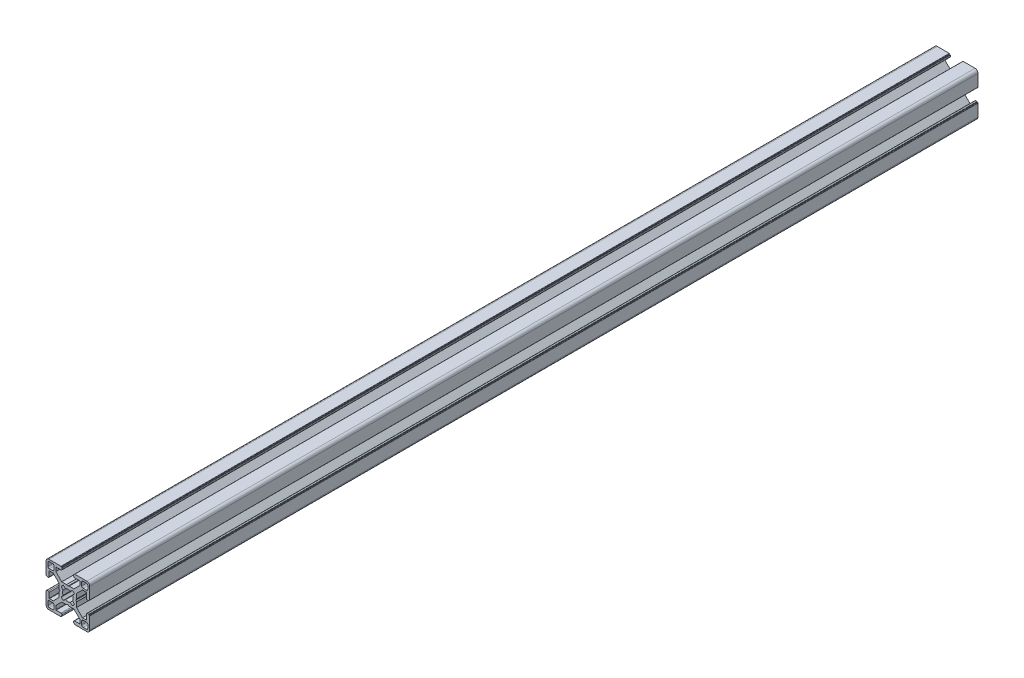
from build123d import *

# Parameters (mm, degrees)
BOSS_EXTRUDE1_DEPTH = 610


with BuildPart() as part:
    # Sketch1 → Boss-Extrude1 (new body)
    with BuildSketch(Plane.XY.offset(25)):
        with BuildLine():
            Line((-4.05, 13.399999434), (-4.05, 14.299999626))
            ThreePointArc((-4.05, 14.299999626), (-4.108578753, 14.441421247), (-4.250000374, 14.5))
            Line((-4.250000374, 14.5), (-4.350000144, 14.5))
            ThreePointArc((-4.350000144, 14.5), (-4.49142109, 14.558578474), (-4.549999564, 14.69999942))
            Line((-4.549999564, 14.69999942), (-4.549999564, 14.799999619))
            ThreePointArc((-4.549999564, 14.799999619), (-4.60857832, 14.941421245), (-4.749999945, 15))
            Line((-4.749999945, 15), (-13.000000346, 15))
            ThreePointArc((-13.000000346, 15), (-14.414213664, 14.414213664), (-15, 13.000000346))
            Line((-15, 13.000000346), (-15, 4.749999521))
            ThreePointArc((-15, 4.749999521), (-14.941421273, 4.608577964), (-14.799999716, 4.549999237))
            Line((-14.799999716, 4.549999237), (-14.700000611, 4.549999237))
            ThreePointArc((-14.700000611, 4.549999237), (-14.558579054, 4.49142051), (-14.500000327, 4.349998953))
            Line((-14.500000327, 4.349998953), (-14.500000327, 4.249999521))
            ThreePointArc((-14.500000327, 4.249999521), (-14.4414216, 4.108577964), (-14.300000043, 4.049999237))
            Line((-14.300000043, 4.049999237), (-13.39999994, 4.049999237))
            ThreePointArc((-13.39999994, 4.049999237), (-12.975735606, 4.225735278), (-12.799999564, 4.649999613))
            Line((-12.799999564, 4.649999613), (-12.799999564, 8.049999716))
            ThreePointArc((-12.799999564, 8.049999716), (-12.741420837, 8.191421273), (-12.59999928, 8.25))
            Line((-12.59999928, 8.25), (-10.049999564, 8.25))
            Line((-10.049999564, 8.25), (-6.00446543, 4.204465866))
            Line((-6.00446543, 4.204465866), (-6.00446543, 0.899999619))
            Line((-6.00446543, 0.899999619), (-5.484852164, 0))
            Line((-5.484852164, 0), (-6.00446543, -0.899999619))
            Line((-6.00446543, -0.899999619), (-6.00446543, -4.204465866))
            Line((-6.00446543, -4.204465866), (-10.049999564, -8.25))
            Line((-10.049999564, -8.25), (-12.59999928, -8.25))
            ThreePointArc((-12.59999928, -8.25), (-12.741420837, -8.191421273), (-12.799999564, -8.049999716))
            Line((-12.799999564, -8.049999716), (-12.799999564, -4.649999613))
            ThreePointArc((-12.799999564, -4.649999613), (-12.975735606, -4.225735278), (-13.39999994, -4.049999237))
            Line((-13.39999994, -4.049999237), (-14.300000043, -4.049999237))
            ThreePointArc((-14.300000043, -4.049999237), (-14.4414216, -4.108577964), (-14.500000327, -4.249999521))
            Line((-14.500000327, -4.249999521), (-14.500000327, -4.349998953))
            ThreePointArc((-14.500000327, -4.349998953), (-14.558579054, -4.49142051), (-14.700000611, -4.549999237))
            Line((-14.700000611, -4.549999237), (-14.799999716, -4.549999237))
            ThreePointArc((-14.799999716, -4.549999237), (-14.941421273, -4.608577964), (-15, -4.749999521))
            Line((-15, -4.749999521), (-15, -13.000000346))
            ThreePointArc((-15, -13.000000346), (-14.414213664, -14.414213664), (-13.000000346, -15))
            Line((-13.000000346, -15), (-4.749999945, -15))
            ThreePointArc((-4.749999945, -15), (-4.60857832, -14.941421245), (-4.549999564, -14.799999619))
            Line((-4.549999564, -14.799999619), (-4.549999564, -14.69999942))
            ThreePointArc((-4.549999564, -14.69999942), (-4.49142109, -14.558578474), (-4.350000144, -14.5))
            Line((-4.350000144, -14.5), (-4.250000374, -14.5))
            ThreePointArc((-4.250000374, -14.5), (-4.108578753, -14.441421247), (-4.05, -14.299999626))
            Line((-4.05, -14.299999626), (-4.05, -13.399999434))
            ThreePointArc((-4.05, -13.399999434), (-4.225735989, -12.975735226), (-4.650000197, -12.799999237))
            Line((-4.650000197, -12.799999237), (-8.049999924, -12.799999237))
            ThreePointArc((-8.049999924, -12.799999237), (-8.191421565, -12.741420475), (-8.250000327, -12.599998834))
            Line((-8.250000327, -12.599998834), (-8.250000327, -10.049999237))
            Line((-8.250000327, -10.049999237), (-4.204466193, -6))
            Line((-4.204466193, -6), (-0.899999946, -6))
            Line((-0.899999946, -6), (0, -5.484851837))
            Line((0, -5.484851837), (0.899999946, -6))
            Line((0.899999946, -6), (4.204466193, -6))
            Line((4.204466193, -6), (8.250000327, -10.049999237))
            Line((8.250000327, -10.049999237), (8.250000327, -12.599998834))
            ThreePointArc((8.250000327, -12.599998834), (8.191421565, -12.741420475), (8.049999924, -12.799999237))
            Line((8.049999924, -12.799999237), (4.650000197, -12.799999237))
            ThreePointArc((4.650000197, -12.799999237), (4.225735989, -12.975735226), (4.05, -13.399999434))
            Line((4.05, -13.399999434), (4.05, -14.299999626))
            ThreePointArc((4.05, -14.299999626), (4.108578753, -14.441421247), (4.250000374, -14.5))
            Line((4.250000374, -14.5), (4.350000144, -14.5))
            ThreePointArc((4.350000144, -14.5), (4.49142109, -14.558578474), (4.549999564, -14.69999942))
            Line((4.549999564, -14.69999942), (4.549999564, -14.799999619))
            ThreePointArc((4.549999564, -14.799999619), (4.60857832, -14.941421245), (4.749999945, -15))
            Line((4.749999945, -15), (13.000000346, -15))
            ThreePointArc((13.000000346, -15), (14.414213664, -14.414213664), (15, -13.000000346))
            Line((15, -13.000000346), (15, -4.749999521))
            ThreePointArc((15, -4.749999521), (14.941421273, -4.608577964), (14.799999716, -4.549999237))
            Line((14.799999716, -4.549999237), (14.700000611, -4.549999237))
            ThreePointArc((14.700000611, -4.549999237), (14.558579054, -4.49142051), (14.500000327, -4.349998953))
            Line((14.500000327, -4.349998953), (14.500000327, -4.249999521))
            ThreePointArc((14.500000327, -4.249999521), (14.4414216, -4.108577964), (14.300000043, -4.049999237))
            Line((14.300000043, -4.049999237), (13.39999994, -4.049999237))
            ThreePointArc((13.39999994, -4.049999237), (12.975735606, -4.225735278), (12.799999564, -4.649999613))
            Line((12.799999564, -4.649999613), (12.799999564, -8.049999716))
            ThreePointArc((12.799999564, -8.049999716), (12.741420837, -8.191421273), (12.59999928, -8.25))
            Line((12.59999928, -8.25), (10.049999564, -8.25))
            Line((10.049999564, -8.25), (6.00446543, -4.204465866))
            Line((6.00446543, -4.204465866), (6.00446543, -0.899999619))
            Line((6.00446543, -0.899999619), (5.484852164, 0))
            Line((5.484852164, 0), (6.00446543, 0.899999619))
            Line((6.00446543, 0.899999619), (6.00446543, 4.204465866))
            Line((6.00446543, 4.204465866), (10.049999564, 8.25))
            Line((10.049999564, 8.25), (12.59999928, 8.25))
            ThreePointArc((12.59999928, 8.25), (12.741420837, 8.191421273), (12.799999564, 8.049999716))
            Line((12.799999564, 8.049999716), (12.799999564, 4.649999613))
            ThreePointArc((12.799999564, 4.649999613), (12.975735606, 4.225735278), (13.39999994, 4.049999237))
            Line((13.39999994, 4.049999237), (14.300000043, 4.049999237))
            ThreePointArc((14.300000043, 4.049999237), (14.4414216, 4.108577964), (14.500000327, 4.249999521))
            Line((14.500000327, 4.249999521), (14.500000327, 4.349998953))
            ThreePointArc((14.500000327, 4.349998953), (14.558579054, 4.49142051), (14.700000611, 4.549999237))
            Line((14.700000611, 4.549999237), (14.799999716, 4.549999237))
            ThreePointArc((14.799999716, 4.549999237), (14.941421273, 4.608577964), (15, 4.749999521))
            Line((15, 4.749999521), (15, 13.000000346))
            ThreePointArc((15, 13.000000346), (14.414213664, 14.414213664), (13.000000346, 15))
            Line((13.000000346, 15), (4.749999945, 15))
            ThreePointArc((4.749999945, 15), (4.60857832, 14.941421245), (4.549999564, 14.799999619))
            Line((4.549999564, 14.799999619), (4.549999564, 14.69999942))
            ThreePointArc((4.549999564, 14.69999942), (4.49142109, 14.558578474), (4.350000144, 14.5))
            Line((4.350000144, 14.5), (4.250000374, 14.5))
            ThreePointArc((4.250000374, 14.5), (4.108578753, 14.441421247), (4.05, 14.299999626))
            Line((4.05, 14.299999626), (4.05, 13.399999434))
            ThreePointArc((4.05, 13.399999434), (4.225735989, 12.975735226), (4.650000197, 12.799999237))
            Line((4.650000197, 12.799999237), (8.049999924, 12.799999237))
            ThreePointArc((8.049999924, 12.799999237), (8.191421565, 12.741420475), (8.250000327, 12.599998834))
            Line((8.250000327, 12.599998834), (8.250000327, 10.049999237))
            Line((8.250000327, 10.049999237), (4.204466193, 6))
            Line((4.204466193, 6), (0.899999946, 6))
            Line((0.899999946, 6), (0, 5.484851837))
            Line((0, 5.484851837), (-0.899999946, 6))
            Line((-0.899999946, 6), (-4.204466193, 6))
            Line((-4.204466193, 6), (-8.250000327, 10.049999237))
            Line((-8.250000327, 10.049999237), (-8.250000327, 12.599998834))
            ThreePointArc((-8.250000327, 12.599998834), (-8.191421565, 12.741420475), (-8.049999924, 12.799999237))
            Line((-8.049999924, 12.799999237), (-4.650000197, 12.799999237))
            ThreePointArc((-4.650000197, 12.799999237), (-4.225735989, 12.975735226), (-4.05, 13.399999434))
        make_face()
        with BuildLine():
            Line((-12.7000011, 13.700000398), (-10.500000318, 13.700000398))
            ThreePointArc((-10.500000318, 13.700000398), (-9.792893543, 13.407107182), (-9.500000327, 12.700000408))
            Line((-9.500000327, 12.700000408), (-9.500000327, 10.499999626))
            ThreePointArc((-9.500000327, 10.499999626), (-9.792893543, 9.792892851), (-10.500000318, 9.499999635))
            Line((-10.500000318, 9.499999635), (-12.7000011, 9.499999635))
            ThreePointArc((-12.7000011, 9.499999635), (-13.407107874, 9.792892851), (-13.70000109, 10.499999626))
            Line((-13.70000109, 10.499999626), (-13.70000109, 12.700000408))
            ThreePointArc((-13.70000109, 12.700000408), (-13.407107874, 13.407107182), (-12.7000011, 13.700000398))
        make_face(mode=Mode.SUBTRACT)
        with BuildLine():
            Line((-10.500000318, -13.700000398), (-12.7000011, -13.700000398))
            ThreePointArc((-12.7000011, -13.700000398), (-13.407107874, -13.407107182), (-13.70000109, -12.700000408))
            Line((-13.70000109, -12.700000408), (-13.70000109, -10.499999626))
            ThreePointArc((-13.70000109, -10.499999626), (-13.407107874, -9.792892851), (-12.7000011, -9.499999635))
            Line((-12.7000011, -9.499999635), (-10.500000318, -9.499999635))
            ThreePointArc((-10.500000318, -9.499999635), (-9.792893543, -9.792892851), (-9.500000327, -10.499999626))
            Line((-9.500000327, -10.499999626), (-9.500000327, -12.700000408))
            ThreePointArc((-9.500000327, -12.700000408), (-9.792893543, -13.407107182), (-10.500000318, -13.700000398))
        make_face(mode=Mode.SUBTRACT)
        with BuildLine():
            Line((10.500000318, 13.700000398), (12.7000011, 13.700000398))
            ThreePointArc((12.7000011, 13.700000398), (13.407107874, 13.407107182), (13.70000109, 12.700000408))
            Line((13.70000109, 12.700000408), (13.70000109, 10.499999626))
            ThreePointArc((13.70000109, 10.499999626), (13.407107874, 9.792892851), (12.7000011, 9.499999635))
            Line((12.7000011, 9.499999635), (10.500000318, 9.499999635))
            ThreePointArc((10.500000318, 9.499999635), (9.792893543, 9.792892851), (9.500000327, 10.499999626))
            Line((9.500000327, 10.499999626), (9.500000327, 12.700000408))
            ThreePointArc((9.500000327, 12.700000408), (9.792893543, 13.407107182), (10.500000318, 13.700000398))
        make_face(mode=Mode.SUBTRACT)
        with BuildLine():
            Line((13.70000109, -10.499999626), (13.70000109, -12.700000408))
            ThreePointArc((13.70000109, -12.700000408), (13.407107874, -13.407107182), (12.7000011, -13.700000398))
            Line((12.7000011, -13.700000398), (10.500000318, -13.700000398))
            ThreePointArc((10.500000318, -13.700000398), (9.792893543, -13.407107182), (9.500000327, -12.700000408))
            Line((9.500000327, -12.700000408), (9.500000327, -10.499999626))
            ThreePointArc((9.500000327, -10.499999626), (9.792893543, -9.792892851), (10.500000318, -9.499999635))
            Line((10.500000318, -9.499999635), (12.7000011, -9.499999635))
            ThreePointArc((12.7000011, -9.499999635), (13.407107874, -9.792892851), (13.70000109, -10.499999626))
        make_face(mode=Mode.SUBTRACT)
        with BuildLine():
            Line((-3.135929412, 4.518400903), (-1.600129524, 3.280561767))
            ThreePointArc((-1.600129524, 3.280561767), (0, 3.65), (1.600129524, 3.280561767))
            Line((1.600129524, 3.280561767), (3.135929412, 4.518400903))
            ThreePointArc((3.135929412, 4.518400903), (3.881002259, 3.897155561), (4.505336892, 3.154669473))
            Line((4.505336892, 3.154669473), (3.280561732, 1.600129597))
            ThreePointArc((3.280561732, 1.600129597), (3.65, 0), (3.280561732, -1.600129597))
            Line((3.280561732, -1.600129597), (4.505336892, -3.154669473))
            ThreePointArc((4.505336892, -3.154669473), (3.881002259, -3.897155561), (3.135929412, -4.518400903))
            Line((3.135929412, -4.518400903), (1.600129524, -3.280561767))
            ThreePointArc((1.600129524, -3.280561767), (0, -3.65), (-1.600129524, -3.280561767))
            Line((-1.600129524, -3.280561767), (-3.135929412, -4.518400903))
            ThreePointArc((-3.135929412, -4.518400903), (-3.881002259, -3.897155561), (-4.505336892, -3.154669473))
            Line((-4.505336892, -3.154669473), (-3.280561732, -1.600129597))
            ThreePointArc((-3.280561732, -1.600129597), (-3.65, 0), (-3.280561732, 1.600129597))
            Line((-3.280561732, 1.600129597), (-4.505336892, 3.154669473))
            ThreePointArc((-4.505336892, 3.154669473), (-3.881002259, 3.897155561), (-3.135929412, 4.518400903))
        make_face(mode=Mode.SUBTRACT)
    extrude(amount=-BOSS_EXTRUDE1_DEPTH)


solid = part.part
